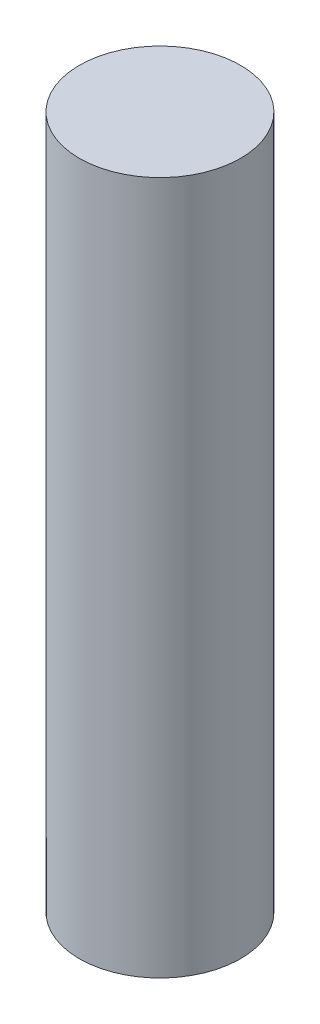
from build123d import *

# Parameters (mm, degrees)
SKETCH1_R           = 5
BOSS_EXTRUDE1_DEPTH = 43


with BuildPart() as part:
    # Sketch1 → Boss-Extrude1 (new body)
    with BuildSketch(Plane(origin=(0, 0, 0), x_dir=(1, 0, 0), z_dir=(0, 1, 0))):
        with Locations(Location((0, 0, 0), (0, 0, 270))):
            Circle(SKETCH1_R)
    extrude(amount=BOSS_EXTRUDE1_DEPTH)


solid = part.part
